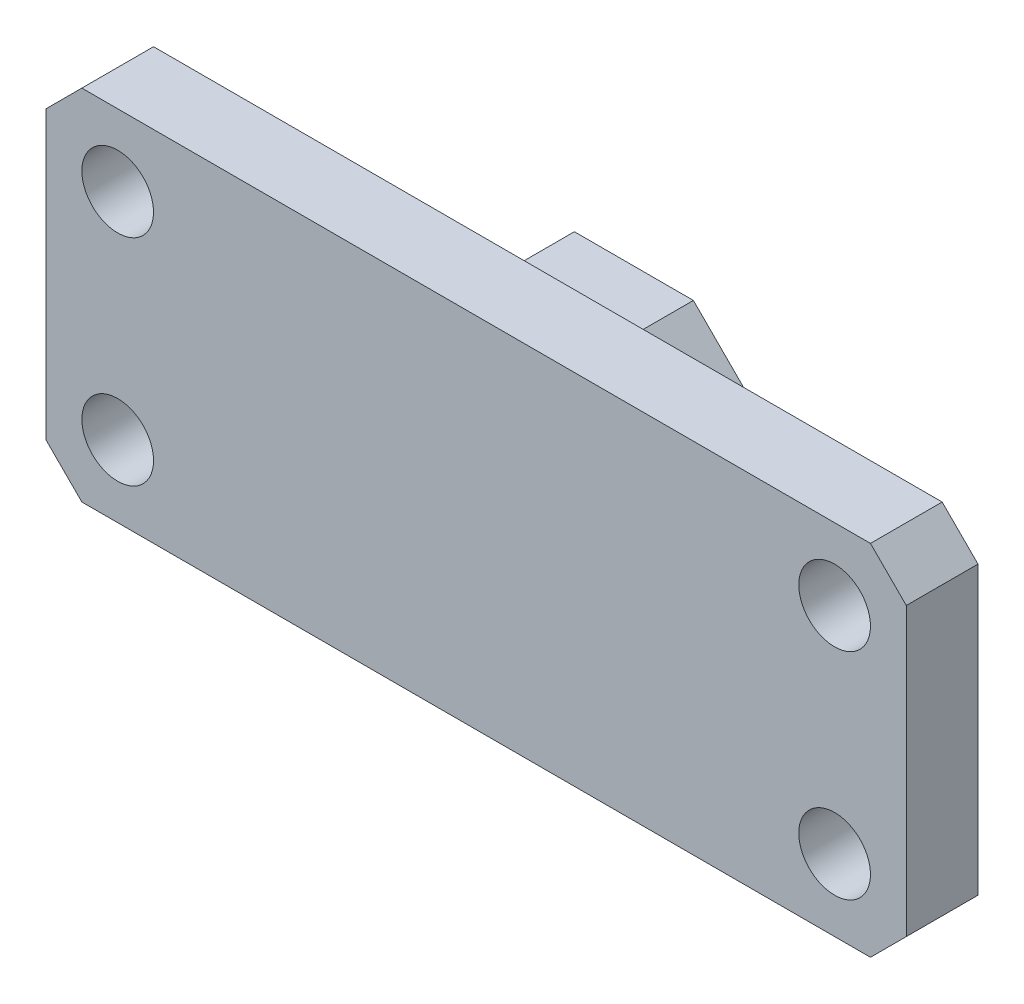
from build123d import *

# Parameters (mm, degrees)
SKETCH_156_W          = 120
SKETCH_156_H          = 50
EXTRUDE_416_DEPTH     = 10
CUT_EXTRUDE_START     = 10
SKETCH_1_5_R          = 5
CUT_EXTRUDE_465_DEPTH = 10
CHAMFER_532_SIZE      = 5
EXTRUDE_START         = -10
EXTRUDE_2_DEPTH       = 22


with BuildPart() as part:
    # Sketch 156 → Extrude 416 (new body)
    with BuildSketch(Plane.XY):
        Rectangle(SKETCH_156_W, SKETCH_156_H)
    extrude(amount=EXTRUDE_416_DEPTH)

    # Эскиз1<5> → Cut-Extrude 465 (cut)
    with BuildSketch(Plane.XY.offset(CUT_EXTRUDE_START)):
        with Locations((50, 15)):
            Circle(SKETCH_1_5_R)
        with Locations(Location((-50, 15, 0), (0, 0, 180))):
            Circle(SKETCH_1_5_R)
        with Locations((-50, -15)):
            Circle(SKETCH_1_5_R)
        with Locations(Location((50, -15, 0), (0, 0, 180))):
            Circle(SKETCH_1_5_R)
    extrude(amount=-CUT_EXTRUDE_465_DEPTH, mode=Mode.SUBTRACT)

    # Chamfer 532
    chamfer_532_edges = [part.edges().sort_by_distance(p)[0] for p in [
        (-60, 25, 5),
        (60, 25, 5),
        (60, -25, 5),
        (-60, -25, 5),
    ]]
    chamfer(chamfer_532_edges, length=CHAMFER_532_SIZE)

    # Эскиз2 → Бобышка-Вытянуть2 (add)
    with BuildSketch(Plane(origin=(0, 0, 0), x_dir=(-1, 0, 0), z_dir=(0, 0, -1)).offset(EXTRUDE_START)):
        Polygon((-8.3, 20), (8.3, 20), (20, 8.3), (35, 8.3), (35, -8.3), (20, -8.3), (8.3, -20), (-8.3, -20), (-20, -8.3), (-35, -8.3), (-35, 8.3), (-20, 8.3), align=None)
    extrude(amount=EXTRUDE_2_DEPTH)


solid = part.part
